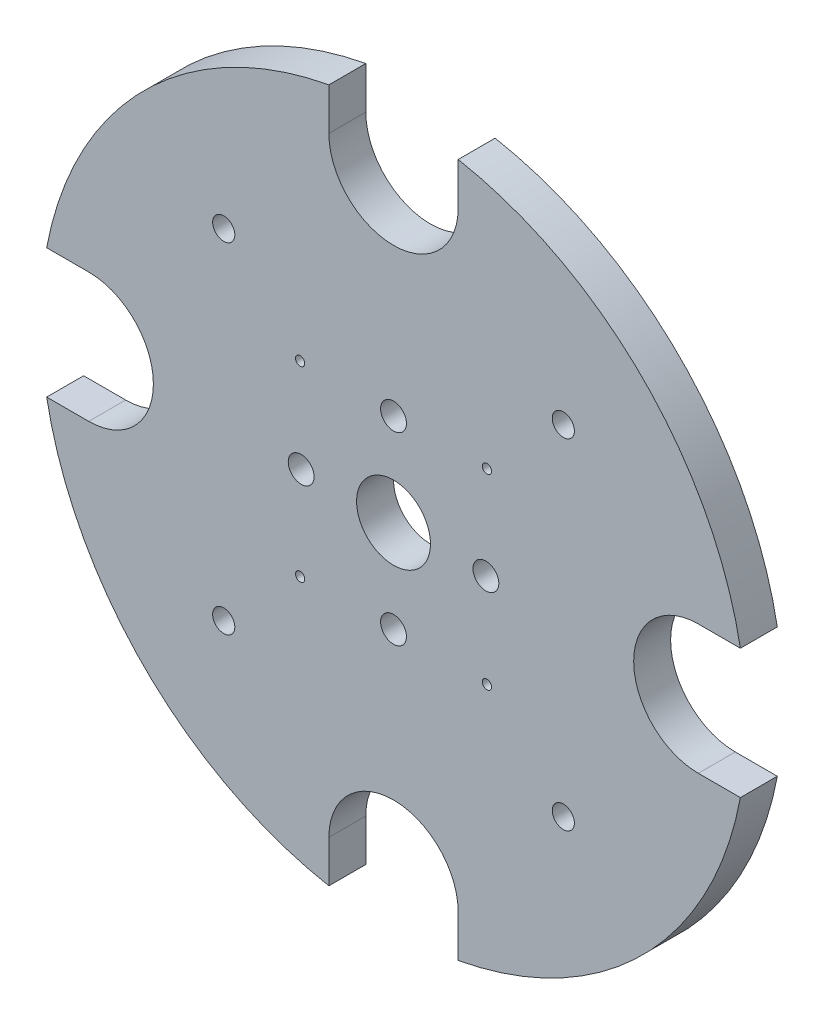
from build123d import *

# Parameters (mm, degrees)
ESQUISSE1_R                  = 191
BASE_EXTRUSION_DEPTH         = 20
ESQUISSE2_R                  = 20
ENL_V_MAT_EXTRU_1_DEPTH      = 20
ESQUISSE3_R                  = 7
ENL_V_MAT_EXTRU_2_DEPTH      = 20
R_P_TITION_CIRCULAIRE1_COUNT = 4
ESQUISSE4_R                  = 6
ESQUISSE4_R_2                = 2.5
ENL_V_MAT_EXTRU_3_DEPTH      = 20
R_P_TITION_CIRCULAIRE2_COUNT = 4
ENL_V_MAT_EXTRU_4_DEPTH      = 271.854204324
R_P_TITION_CIRCULAIRE3_COUNT = 4


with BuildPart() as part:
    # Esquisse1 → Base-Extrusion (new body)
    with BuildSketch(Plane.XY):
        Circle(ESQUISSE1_R)
    extrude(amount=BASE_EXTRUSION_DEPTH)

    # Esquisse2 → Enlèv. mat.-Extru.1 (cut)
    with BuildSketch(Plane.XY.offset(20)):
        Circle(ESQUISSE2_R)
    extrude(amount=-ENL_V_MAT_EXTRU_1_DEPTH, mode=Mode.SUBTRACT)

    # Esquisse3 → Enlèv. mat.-Extru.2 (cut)
    with BuildSketch(Plane.XY.offset(20)):
        with Locations((50, 0)):
            Circle(ESQUISSE3_R)
    enl_v_mat_extru_2 = extrude(amount=-ENL_V_MAT_EXTRU_2_DEPTH, mode=Mode.SUBTRACT)

    # Répétition circulaire1: Enlèv. mat.-Extru.2 ×4 about axis
    r_p_tition_circulaire1_axis = Axis((0, 0, 0), (0, 0, -1))
    for i in range(1, R_P_TITION_CIRCULAIRE1_COUNT):
        add(enl_v_mat_extru_2.rotate(r_p_tition_circulaire1_axis, i * 360 / R_P_TITION_CIRCULAIRE1_COUNT), mode=Mode.SUBTRACT)

    # Esquisse4 → Enlèv. mat.-Extru.3 (cut)
    with BuildSketch(Plane.XY.offset(20)):
        with Locations((91.923881554, 91.923881554)):
            Circle(ESQUISSE4_R)
        with Locations((50.558134855, 50.558134855)):
            Circle(ESQUISSE4_R_2)
    enl_v_mat_extru_3 = extrude(amount=-ENL_V_MAT_EXTRU_3_DEPTH, mode=Mode.SUBTRACT)

    # Répétition circulaire2: Enlèv. mat.-Extru.3 ×4 about axis
    r_p_tition_circulaire2_axis = Axis((0, 0, 0), (0, 0, -1))
    for i in range(1, R_P_TITION_CIRCULAIRE2_COUNT):
        add(enl_v_mat_extru_3.rotate(r_p_tition_circulaire2_axis, i * 360 / R_P_TITION_CIRCULAIRE2_COUNT), mode=Mode.SUBTRACT)

    # Esquisse5 → Enlèv. mat.-Extru.4 (cut, through all)
    with BuildSketch(Plane.XY.offset(20)):
        with BuildLine():
            Line((-35, 187.765811585), (-35, 165))
            ThreePointArc((-35, 165), (0, 130), (35, 165))
            Line((35, 165), (35, 187.765811585))
            ThreePointArc((35, 187.765811585), (0, 191), (-35, 187.765811585))
        make_face()
    enl_v_mat_extru_4 = extrude(amount=-ENL_V_MAT_EXTRU_4_DEPTH, mode=Mode.SUBTRACT)

    # Répétition circulaire3: Enlèv. mat.-Extru.4 ×4 about axis
    r_p_tition_circulaire3_axis = Axis((0, 0, 0), (0, 0, -1))
    for i in range(1, R_P_TITION_CIRCULAIRE3_COUNT):
        add(enl_v_mat_extru_4.rotate(r_p_tition_circulaire3_axis, i * 360 / R_P_TITION_CIRCULAIRE3_COUNT), mode=Mode.SUBTRACT)


solid = part.part
